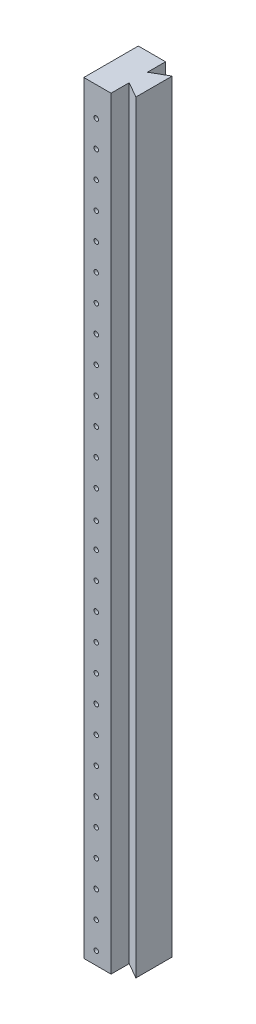
from build123d import *

# Parameters (mm, degrees)
BOSS_EXTRUDE1_DEPTH         = 355.6
F_27_0_144_DIAMETER_HOLE1_D = 2.100000118


with BuildPart() as part:
    # Sketch1 → Boss-Extrude1 (new body)
    with BuildSketch(Plane(origin=(0, 0, 0), x_dir=(1, 0, 0), z_dir=(0, 1, 0))):
        Polygon((-24.676553482, 0), (-24.676553482, -25.4), (-11.976553482, -25.4), (-11.976553482, -16.933333333), (-4.644205064, -21.166666667), (-4.644205064, -4.233333333), (-11.976553482, -8.466666667), (-11.976553482, 0), align=None)
    extrude(amount=BOSS_EXTRUDE1_DEPTH)

    # #27 (0.144) Diameter Hole1 (through all)
    with Locations(Plane(origin=(0, 0, 0), x_dir=(-1, 0, 0), z_dir=(0, 0, -1))):
        with Locations((18.879197864, 341.956469662), (18.879197864, 329.626469662), (18.879197864, 317.180469662), (18.879197864, 304.734469662), (18.879197864, 292.288469662), (18.879197864, 279.842469662), (18.879197864, 267.396469662), (18.879197864, 254.950469662), (18.879197864, 242.504469662), (18.879197864, 230.058469662), (18.879197864, 217.612469662), (18.879197864, 205.166469662), (18.879197864, 192.720469662), (18.879197864, 179.588809686), (18.879197864, 167.828469662), (18.879197864, 155.382469662), (18.879197864, 142.936469662), (18.879197864, 130.490469662), (18.879197864, 118.044469662), (18.879197864, 105.598469662), (18.879197864, 93.152469662), (18.879197864, 80.706469662), (18.879197864, 68.260469662), (18.879197864, 55.814469662), (18.879197864, 43.368469662), (18.879197864, 30.922469662), (18.879197864, 18.476469662), (18.879197864, 6.030469662)):
            Hole(F_27_0_144_DIAMETER_HOLE1_D / 2)


solid = part.part
